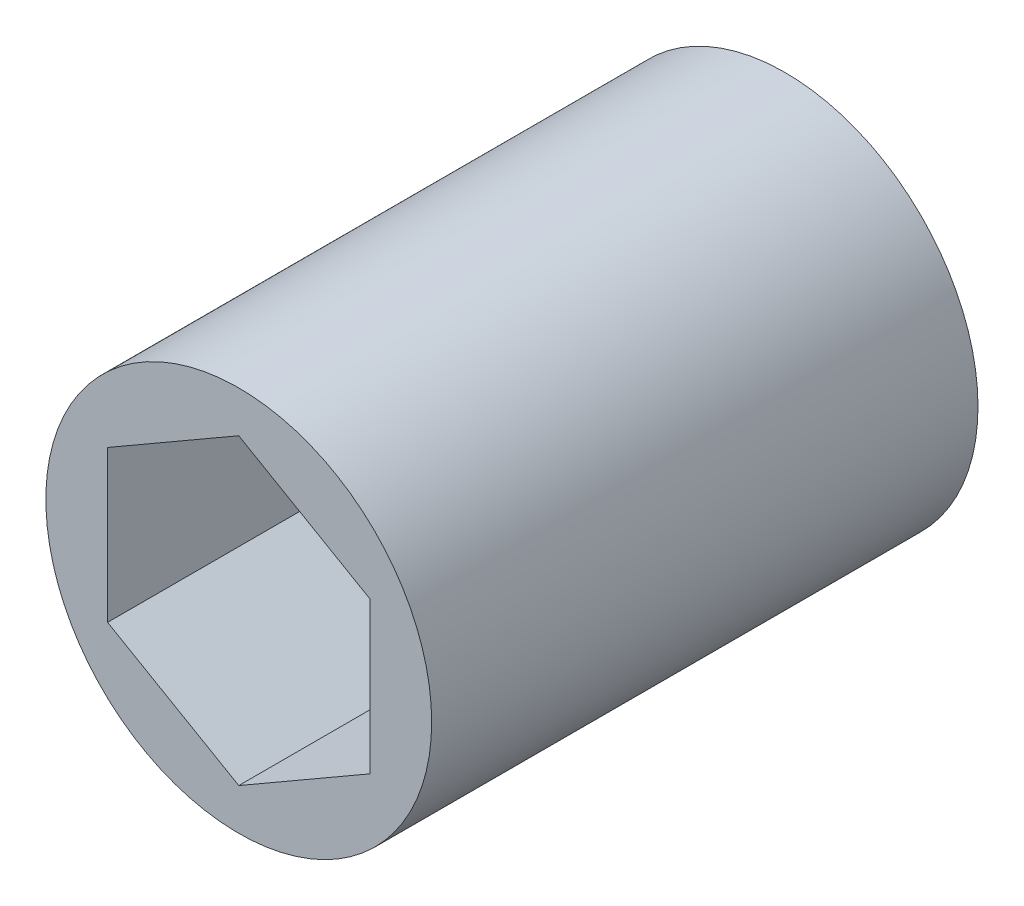
from build123d import *

# Parameters (mm, degrees)
SKETCH1_R           = 9.525
BOSS_EXTRUDE1_DEPTH = 13.4874


with BuildPart() as part:
    # Sketch1 → Boss-Extrude1 (new, symmetric)
    with BuildSketch(Plane.XY):
        Circle(SKETCH1_R)
        Polygon((0, 7.478995387), (-6.477, 3.739497694), (-6.477, -3.739497694), (0, -7.478995387), (6.477, -3.739497694), (6.477, 3.739497694), align=None, mode=Mode.SUBTRACT)
    extrude(amount=BOSS_EXTRUDE1_DEPTH, both=True)


solid = part.part
